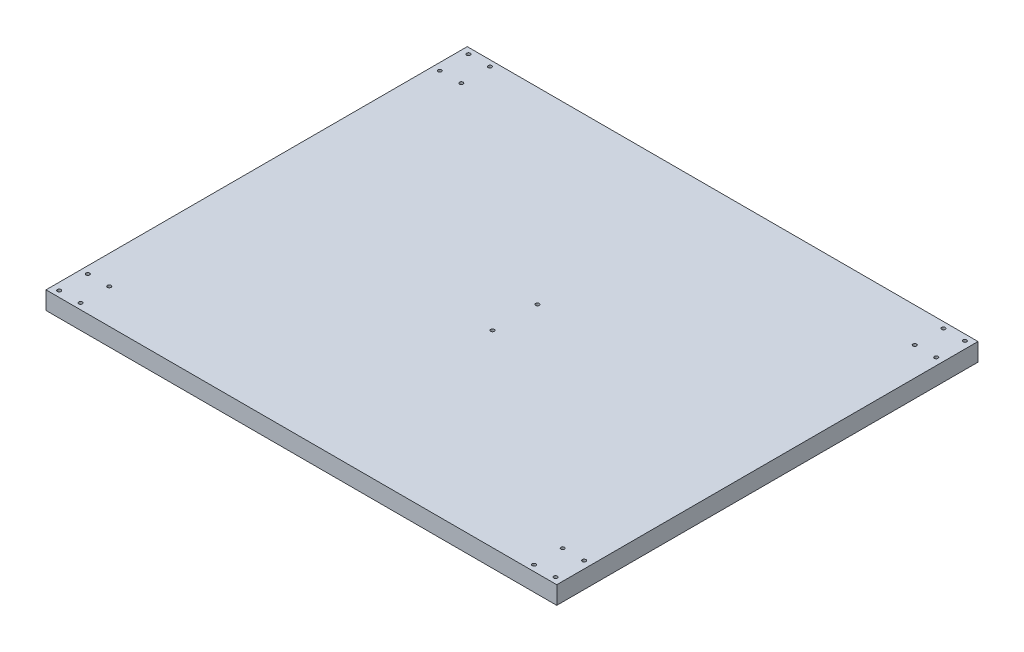
from build123d import *

# Parameters (mm, degrees)
CROQUIS1_W              = 428
CROQUIS1_H              = 353
CROQUIS1_R              = 1.5
SALIENTE_EXTRUIR1_DEPTH = 15
CROQUIS3_R              = 1.5
CORTAR_EXTRUIR1_DEPTH   = 278.80073794


with BuildPart() as part:
    # Croquis1 → Saliente-Extruir1 (new body)
    with BuildSketch(Plane(origin=(0, 0, 0), x_dir=(1, 0, 0), z_dir=(0, 1, 0))):
        Rectangle(CROQUIS1_W, CROQUIS1_H)
        with Locations(Location((2.5, 18.8, 0), (0, 0, 270))):
            Circle(CROQUIS1_R, mode=Mode.SUBTRACT)
        with Locations(Location((2.5, -18.8, 0), (0, 0, 270))):
            Circle(CROQUIS1_R, mode=Mode.SUBTRACT)
    extrude(amount=SALIENTE_EXTRUIR1_DEPTH)

    # Croquis3 → Cortar-Extruir1 (cut, through all)
    with BuildSketch(Plane(origin=(0, 15, 0), x_dir=(1, 0, 0), z_dir=(0, 1, 0))):
        with Locations(Location((208, -171.5, 0), (0, 0, 270))):
            Circle(CROQUIS3_R)
        with Locations(Location((190, -171.5, 0), (0, 0, 270))):
            Circle(CROQUIS3_R)
        with Locations(Location((190, -147.5, 0), (0, 0, 270))):
            Circle(CROQUIS3_R)
        with Locations(Location((208, -147.5, 0), (0, 0, 270))):
            Circle(CROQUIS3_R)
        with Locations(Location((-208, -171.5, 0), (0, 0, 90))):
            Circle(CROQUIS3_R)
        with Locations(Location((-190, -171.5, 0), (0, 0, 90))):
            Circle(CROQUIS3_R)
        with Locations(Location((-208, -147.5, 0), (0, 0, 90))):
            Circle(CROQUIS3_R)
        with Locations(Location((-190, -147.5, 0), (0, 0, 90))):
            Circle(CROQUIS3_R)
        with Locations(Location((-208, 171.5, 0), (0, 0, 270))):
            Circle(CROQUIS3_R)
        with Locations(Location((-190, 171.5, 0), (0, 0, 270))):
            Circle(CROQUIS3_R)
        with Locations(Location((-190, 147.5, 0), (0, 0, 270))):
            Circle(CROQUIS3_R)
        with Locations(Location((-208, 147.5, 0), (0, 0, 270))):
            Circle(CROQUIS3_R)
        with Locations(Location((208, 171.5, 0), (0, 0, 90))):
            Circle(CROQUIS3_R)
        with Locations(Location((190, 171.5, 0), (0, 0, 90))):
            Circle(CROQUIS3_R)
        with Locations(Location((190, 147.5, 0), (0, 0, 90))):
            Circle(CROQUIS3_R)
        with Locations(Location((208, 147.5, 0), (0, 0, 90))):
            Circle(CROQUIS3_R)
    extrude(amount=-CORTAR_EXTRUIR1_DEPTH, mode=Mode.SUBTRACT)


solid = part.part
